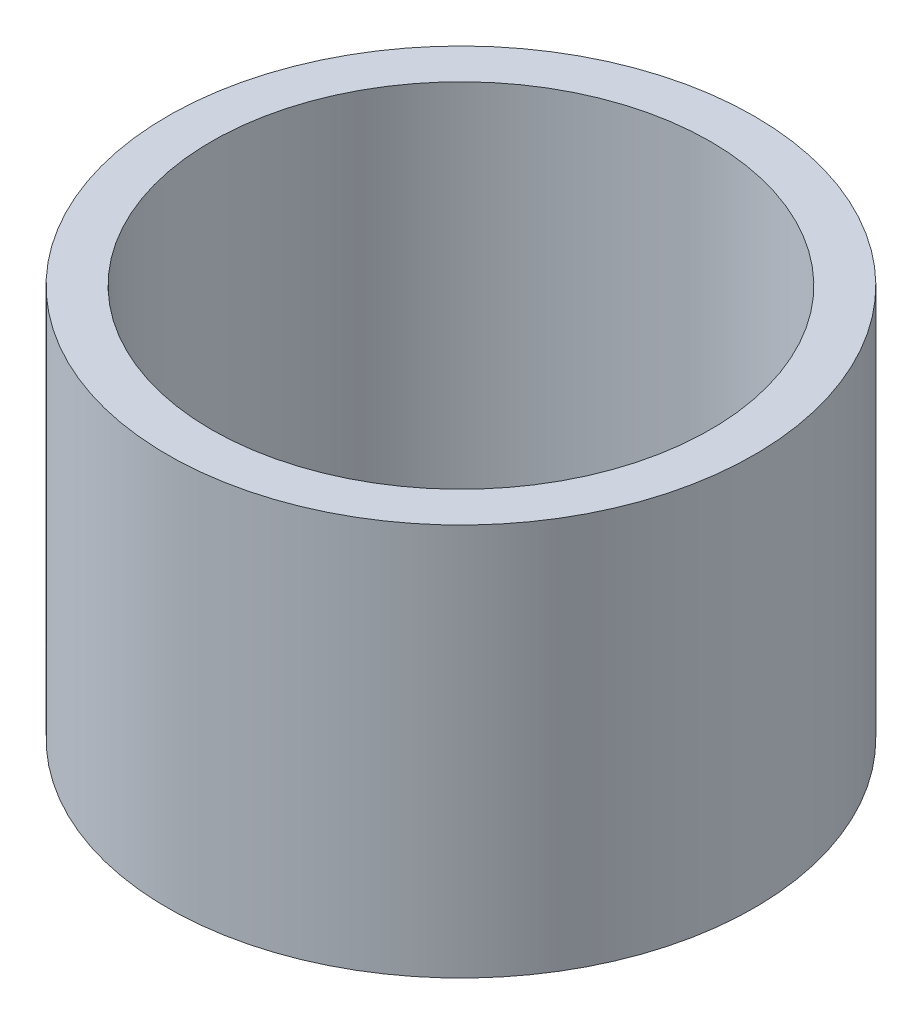
from build123d import *

# Parameters (mm, degrees)
ESBO_O1_W = 3.1
ESBO_O1_H = 27.75


with BuildPart() as part:
    # Esboço1 → Revolução1 (revolve)
    with BuildSketch(Plane.XY, mode=Mode.PRIVATE) as revolu_o1_sk:
        with Locations((19.2, 13.875)):
            Rectangle(ESBO_O1_W, ESBO_O1_H)
    revolve(revolu_o1_sk.sketch.rotate(Axis((0, -52.098568507, 0), (0, 1, 0)), 90), axis=Axis((0, -52.098568507, 0), (0, 1, 0)))


solid = part.part
